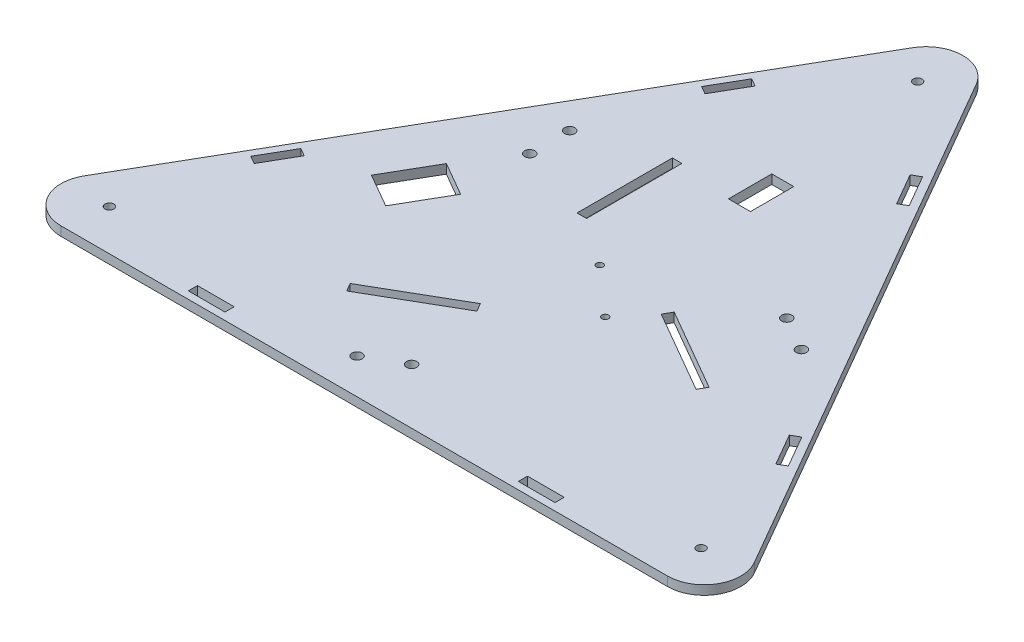
from build123d import *

# Parameters (mm, degrees)
BOSS_EXTRUDE1_DEPTH = 3.175
SKETCH2_W           = 3.302
SKETCH2_H           = 33.02
SKETCH2_R           = 1.778
CUT_EXTRUDE1_DEPTH  = 195.021684248
SKETCH3_R           = 1.524
CUT_EXTRUDE2_DEPTH  = 195.021684248
SKETCH4_R           = 1.143
CUT_EXTRUDE3_DEPTH  = 195.021684248
FILLET1_R           = 12.7
SKETCH5_W           = 12.7
SKETCH5_H           = 3.175
CUT_EXTRUDE4_DEPTH  = 179.341965104
CUT_EXTRUDE5_DEPTH  = 179.341965104
SKETCH9_W           = 7.62
SKETCH9_H           = 15
CUT_EXTRUDE8_DEPTH  = 179.341965104


with BuildPart() as part:
    # Sketch1 → Boss-Extrude1 (new body)
    with BuildSketch(Plane(origin=(0, 0, 0), x_dir=(1, 0, 0), z_dir=(0, 1, 0))):
        Polygon((0, 146.646968374), (-127, -73.323484187), (127, -73.323484187), align=None)
    extrude(amount=BOSS_EXTRUDE1_DEPTH)

    # Sketch2 → Cut-Extrude1 (cut, through all)
    with BuildSketch(Plane(origin=(0, 3.175, 0), x_dir=(1, 0, 0), z_dir=(0, 1, 0))):
        with Locations((-17.907, 36.399572365)):
            Rectangle(SKETCH2_W, SKETCH2_H)
        with Locations(Location((-45.522797213, 43.314369578, 0), (0, 0, 270))):
            Circle(SKETCH2_R)
        with Locations(Location((-45.522797213, 29.484775151, 0), (0, 0, 270))):
            Circle(SKETCH2_R)
        with Locations(Location((-14.749945797, -61.081083627, 0), (0, 0, 270))):
            Circle(SKETCH2_R)
        with Locations(Location((-2.773165699, -54.166286414, 0), (0, 0, 270))):
            Circle(SKETCH2_R)
        Polygon((-7.445874938, -26.882511029), (-9.096874938, -24.022895146), (-37.693033771, -40.532895146), (-36.042033771, -43.392511029), align=None)
        Polygon((55.600033771, -9.517061335), (27.003874938, 6.992938665), (25.352874938, 4.133322782), (53.949033771, -12.376677218), align=None)
        with Locations(Location((48.295962913, 24.681511262, 0), (0, 0, 270))):
            Circle(SKETCH2_R)
        with Locations(Location((60.27274301, 17.766714049, 0), (0, 0, 270))):
            Circle(SKETCH2_R)
    extrude(amount=-CUT_EXTRUDE1_DEPTH, mode=Mode.SUBTRACT)

    # Sketch3 → Cut-Extrude2 (cut, through all)
    with BuildSketch(Plane(origin=(0, 3.175, 0), x_dir=(1, 0, 0), z_dir=(0, 1, 0))):
        with Locations(Location((0, 118.312139176, 0), (0, 0, 270))):
            Circle(SKETCH3_R)
        with Locations(Location((-102.461318102, -59.156069588, 0), (0, 0, 270))):
            Circle(SKETCH3_R)
        with Locations(Location((102.461318102, -59.156069588, 0), (0, 0, 270))):
            Circle(SKETCH3_R)
    extrude(amount=-CUT_EXTRUDE2_DEPTH, mode=Mode.SUBTRACT)

    # Sketch4 → Cut-Extrude3 (cut, through all)
    with BuildSketch(Plane(origin=(0, 3.175, 0), x_dir=(1, 0, 0), z_dir=(0, 1, 0))):
        with Locations(Location((0, 8.207705491, 0), (0, 0, 270))):
            Circle(SKETCH4_R)
        with Locations(Location((16.51, -6.397294509, 0), (0, 0, 270))):
            Circle(SKETCH4_R)
    extrude(amount=-CUT_EXTRUDE3_DEPTH, mode=Mode.SUBTRACT)

    # Fillet1
    fillet1_edges = [part.edges().sort_by_distance(p)[0] for p in [
        (127, 1.5875, 73.323484187),
        (-127, 1.5875, 73.323484187),
        (0, 1.5875, -146.646968374),
    ]]
    fillet(fillet1_edges, radius=FILLET1_R)

    # Sketch5 → Cut-Extrude4 (cut, through all)
    with BuildSketch(Plane(origin=(0, 3.175, 0), x_dir=(1, 0, 0), z_dir=(0, 1, 0))):
        with Locations((-57.15, -69.195984187)):
            Rectangle(SKETCH5_W, SKETCH5_H)
        with Locations((57.15, -69.195984187)):
            Rectangle(SKETCH5_W, SKETCH5_H)
        Polygon((92.931850743, -19.395718754), (86.581850743, -8.397196126), (83.832220086, -9.984696126), (90.182220086, -20.983218754), align=None)
        Polygon((33.032220086, 78.003484899), (35.781850743, 79.590984899), (29.431850743, 90.589507527), (26.682220086, 89.002007527), align=None)
        Polygon((-29.550295474, 90.384355234), (-35.900295474, 79.385832606), (-33.150664817, 77.798332606), (-26.800664817, 88.796855234), align=None)
        Polygon((-83.950664817, -10.189848419), (-86.700295474, -8.602348419), (-93.050295474, -19.600871047), (-90.300664817, -21.188371047), align=None)
    extrude(amount=-CUT_EXTRUDE4_DEPTH, mode=Mode.SUBTRACT)

    # Sketch6 → Cut-Extrude5 (cut, through all)
    with BuildSketch(Plane(origin=(0, 3.175, 0), x_dir=(1, 0, 0), z_dir=(0, 1, 0))):
        Polygon((-54.829873821, -11.096773597), (-45.329873821, 5.357709075), (-56.988307807, 12.088709075), (-66.488307807, -4.365773597), align=None)
    extrude(amount=-CUT_EXTRUDE5_DEPTH, mode=Mode.SUBTRACT)

    # Sketch9 → Cut-Extrude8 (cut, through all)
    with BuildSketch(Plane(origin=(0, 3.175, 0), x_dir=(1, 0, 0), z_dir=(0, 1, 0))):
        with Locations((6.254067487, 57.836284876)):
            Rectangle(SKETCH9_W, SKETCH9_H)
    extrude(amount=-CUT_EXTRUDE8_DEPTH, mode=Mode.SUBTRACT)


solid = part.part
